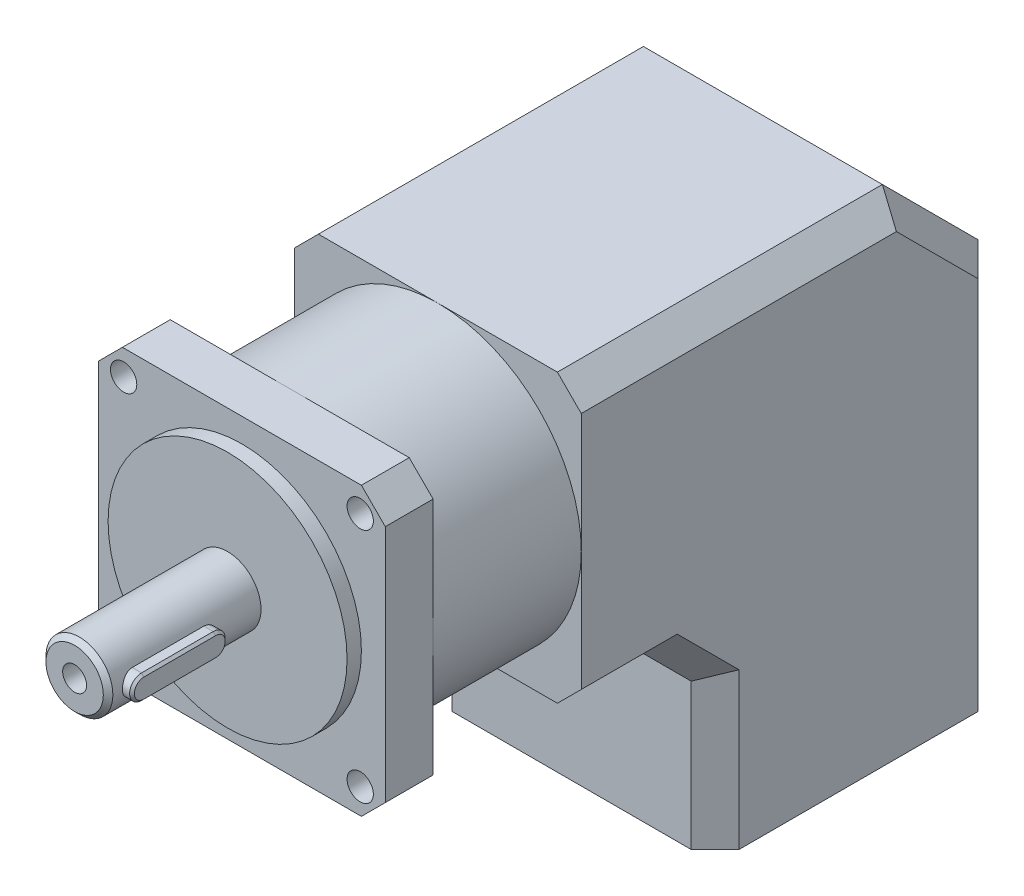
from build123d import *

# Parameters (mm, degrees)
EXTRUDE_1_DEPTH     = 30
CHAMFER_1_SIZE      = 10
CHAMFER_2_SIZE      = 5
SKETCH_2_R          = 30
EXTRUDE_2_DEPTH     = 41
EXTRUDE_3_DEPTH     = 10
SKETCH_4_R          = 25
EXTRUDE_4_DEPTH     = 3
SKETCH_5_R          = 7
EXTRUDE_5_DEPTH     = 35
CUT_EXTRUDE_1_REACH = 147.399
SKETCH_6_R          = 2.75
SKETCH_8_R          = 25
CUT_EXTRUDE_2_DEPTH = 5
SKETCH_9_R          = 7
CUT_EXTRUDE_3_DEPTH = 31.5
EXTRUDE_6_DEPTH     = 9
CHAMFER_3_SIZE      = 0.5
SKETCH_11_R         = 2
CUT_EXTRUDE_4_DEPTH = 30
SKETCH_12_R         = 2.5
CUT_EXTRUDE_5_DEPTH = 30
CHAMFER_4_SIZE      = 1


with BuildPart() as part:
    # 草图1 → 凸台-拉伸1 (new, symmetric)
    with BuildSketch(Plane(origin=(0, 0, 0), x_dir=(0, 0, -1), z_dir=(1, 0, 0))):
        Polygon((0, 0), (0, -40.5), (60, -40.5), (60, 40), (40, 60), (-28, 60), (-28, 0), align=None)
    extrude(amount=EXTRUDE_1_DEPTH, both=True)

    # 倒角1
    chamfer_1_edges = [part.edges().sort_by_distance(p)[0] for p in [
        (0, 0, 0),
    ]]
    chamfer(chamfer_1_edges, length=CHAMFER_1_SIZE)

    # 倒角2
    chamfer_2_edges = [part.edges().sort_by_distance(p)[0] for p in [
        (-30, 0, 19),
        (30, -0.25, -60),
        (30, 50, -50),
        (-30, -25.25, 0),
        (30, -25.25, 0),
        (-30, -5, 5),
        (30, -5, 5),
        (30, 60, -6),
        (30, 0, 19),
        (-30, 60, -6),
        (-30, 50, -50),
        (-30, -0.25, -60),
    ]]
    chamfer(chamfer_2_edges, length=CHAMFER_2_SIZE)

    # 草图2 → 凸台-拉伸2 (add)
    with BuildSketch(Plane.XY.offset(28)):
        with Locations((0, 30)):
            Circle(SKETCH_2_R)
    extrude(amount=EXTRUDE_2_DEPTH)

    # 草图3 → 凸台-拉伸3 (add)
    with BuildSketch(Plane.XY.offset(69)):
        Polygon((-30, 30), (-30, 5), (-25, 0), (25, 0), (30, 5), (30, 30), (30, 55), (25, 60), (0, 60), (-25, 60), (-30, 55), align=None)
    extrude(amount=-EXTRUDE_3_DEPTH)

    # 草图4 → 凸台-拉伸4 (add)
    with BuildSketch(Plane.XY.offset(69)):
        with Locations((0, 30)):
            Circle(SKETCH_4_R)
    extrude(amount=EXTRUDE_4_DEPTH)

    # 草图5 → 凸台-拉伸5 (add)
    with BuildSketch(Plane.XY.offset(69)):
        with Locations((0, 30)):
            Circle(SKETCH_5_R)
    extrude(amount=EXTRUDE_5_DEPTH)

    # 草图6 → 切除-拉伸1 (cut, up to next)
    with BuildSketch(Plane.XY.offset(69), mode=Mode.PRIVATE) as cut_extrude_1_sk1:
        with Locations((-24.748737342, 54.748737342)):
            Circle(SKETCH_6_R)
    cut_extrude_1_tool1 = extrude(cut_extrude_1_sk1.sketch, amount=-CUT_EXTRUDE_1_REACH, mode=Mode.PRIVATE) & part.part
    # 草图6 → 切除-拉伸1 (cut, up to next)
    with BuildSketch(Plane.XY.offset(69), mode=Mode.PRIVATE) as cut_extrude_1_sk2:
        with Locations((24.748737342, 54.748737342)):
            Circle(SKETCH_6_R)
    cut_extrude_1_tool2 = extrude(cut_extrude_1_sk2.sketch, amount=-CUT_EXTRUDE_1_REACH, mode=Mode.PRIVATE) & part.part
    # 草图6 → 切除-拉伸1 (cut, up to next)
    with BuildSketch(Plane.XY.offset(69), mode=Mode.PRIVATE) as cut_extrude_1_sk3:
        with Locations((24.748737342, 5.251262658)):
            Circle(SKETCH_6_R)
    cut_extrude_1_tool3 = extrude(cut_extrude_1_sk3.sketch, amount=-CUT_EXTRUDE_1_REACH, mode=Mode.PRIVATE) & part.part
    # 草图6 → 切除-拉伸1 (cut, up to next)
    with BuildSketch(Plane.XY.offset(69), mode=Mode.PRIVATE) as cut_extrude_1_sk4:
        with Locations((-24.748737342, 5.251262658)):
            Circle(SKETCH_6_R)
    cut_extrude_1_tool4 = extrude(cut_extrude_1_sk4.sketch, amount=-CUT_EXTRUDE_1_REACH, mode=Mode.PRIVATE) & part.part
    add(cut_extrude_1_tool1.solids().sort_by_distance((-24.748737, 54.748737, 69))[0], mode=Mode.SUBTRACT)
    add(cut_extrude_1_tool2.solids().sort_by_distance((24.748737, 54.748737, 69))[0], mode=Mode.SUBTRACT)
    add(cut_extrude_1_tool3.solids().sort_by_distance((24.748737, 5.251263, 69))[0], mode=Mode.SUBTRACT)
    add(cut_extrude_1_tool4.solids().sort_by_distance((-24.748737, 5.251263, 69))[0], mode=Mode.SUBTRACT)

    # 草图8 → 切除-拉伸2 (cut)
    with BuildSketch(Plane.XZ.offset(40.5)):
        with Locations(Location((0, -30, 0), (0, 0, 270))):
            Circle(SKETCH_8_R)
    extrude(amount=-CUT_EXTRUDE_2_DEPTH, mode=Mode.SUBTRACT)

    # 草图9 → 切除-拉伸3 (cut)
    with BuildSketch(Plane.XZ.offset(40.5)):
        with Locations(Location((0, -30, 0), (0, 0, 270))):
            Circle(SKETCH_9_R)
    extrude(amount=-CUT_EXTRUDE_3_DEPTH, mode=Mode.SUBTRACT)

    # 草图10 → 凸台-拉伸6 (add)
    with BuildSketch(Plane(origin=(0, 0, 0), x_dir=(0, 0, -1), z_dir=(1, 0, 0))):
        with BuildLine():
            Line((-98.5, 32.5), (-83.5, 32.5))
            ThreePointArc((-83.5, 32.5), (-81, 30), (-83.5, 27.5))
            Line((-83.5, 27.5), (-98.5, 27.5))
            ThreePointArc((-98.5, 27.5), (-101, 30), (-98.5, 32.5))
        make_face()
    extrude(amount=EXTRUDE_6_DEPTH)

    # 倒角3
    chamfer_3_edges = [part.edges().sort_by_distance(p)[0] for p in [
        (9, 30, 101),
        (9, 27.5, 91),
        (9, 30, 81),
        (9, 32.5, 91),
    ]]
    chamfer(chamfer_3_edges, length=CHAMFER_3_SIZE)

    # 草图11 → 切除-拉伸4 (cut)
    with BuildSketch(Plane.XZ.offset(40.5)):
        with Locations(Location((-24.748737342, -5.251262658, 0), (0, 0, 270))):
            Circle(SKETCH_11_R)
        with Locations(Location((24.748737342, -5.251262658, 0), (0, 0, 270))):
            Circle(SKETCH_11_R)
        with Locations(Location((24.748737342, -54.748737342, 0), (0, 0, 270))):
            Circle(SKETCH_11_R)
        with Locations(Location((-24.748737342, -54.748737342, 0), (0, 0, 270))):
            Circle(SKETCH_11_R)
    extrude(amount=-CUT_EXTRUDE_4_DEPTH, mode=Mode.SUBTRACT)

    # 草图12 → 切除-拉伸5 (cut)
    with BuildSketch(Plane.XY.offset(104)):
        with Locations((0, 30)):
            Circle(SKETCH_12_R)
    extrude(amount=-CUT_EXTRUDE_5_DEPTH, mode=Mode.SUBTRACT)

    # 倒角4
    chamfer_4_edges = [part.edges().sort_by_distance(p)[0] for p in [
        (-7, 30, 104),
    ]]
    chamfer(chamfer_4_edges, length=CHAMFER_4_SIZE)


solid = part.part
